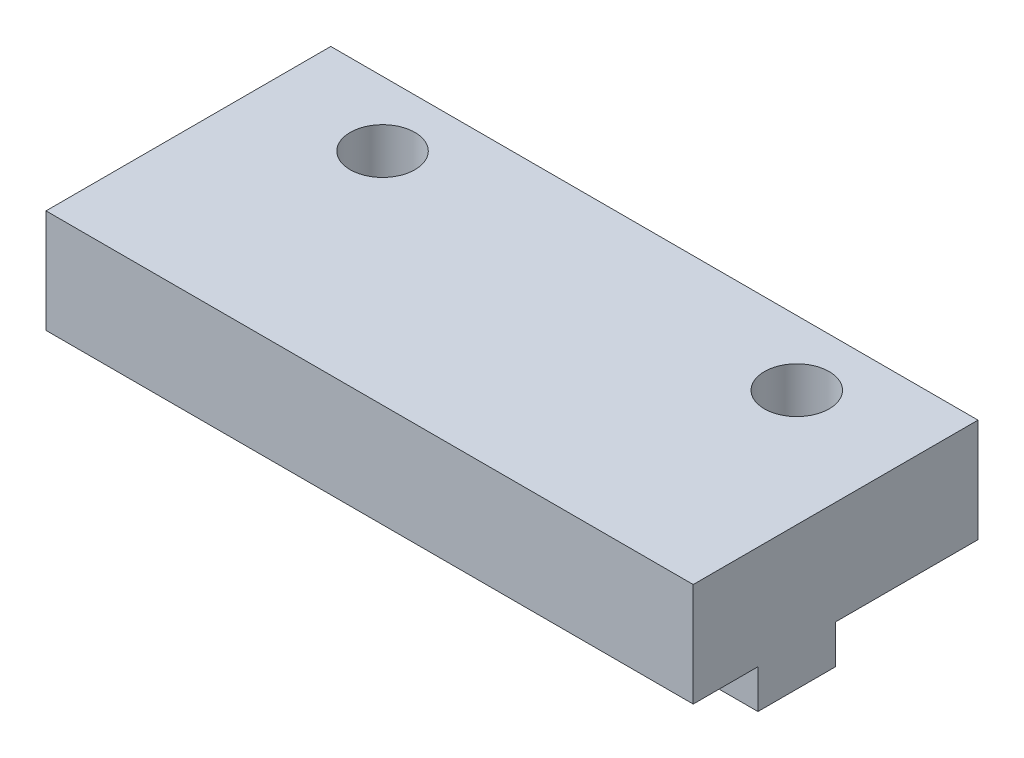
from build123d import *

# Parameters (mm, degrees)
SKETCH1_W           = 25
SKETCH1_H           = 5
SKETCH1_R           = 1.25
BOSS_EXTRUDE1_DEPTH = 4
SKETCH2_W           = 25
SKETCH2_H           = 4
BOSS_EXTRUDE2_DEPTH = 6
SKETCH3_W           = 25
SKETCH3_H           = 3
BOSS_EXTRUDE3_DEPTH = 1.5


with BuildPart() as part:
    # Sketch1 → Boss-Extrude1 (new body)
    with BuildSketch(Plane(origin=(0, 0, 0), x_dir=(1, 0, 0), z_dir=(0, 1, 0))):
        with Locations((12.5, 2.5)):
            Rectangle(SKETCH1_W, SKETCH1_H)
        with Locations(Location((4.5, 2.5, 0), (0, 0, 270))):
            Circle(SKETCH1_R, mode=Mode.SUBTRACT)
        with Locations(Location((20.5, 2.5, 0), (0, 0, 270))):
            Circle(SKETCH1_R, mode=Mode.SUBTRACT)
    extrude(amount=BOSS_EXTRUDE1_DEPTH)

    # Sketch2 → Boss-Extrude2 (add)
    with BuildSketch(Plane.XY):
        with Locations((12.5, 2)):
            Rectangle(SKETCH2_W, SKETCH2_H)
    extrude(amount=BOSS_EXTRUDE2_DEPTH)

    # Sketch3 → Boss-Extrude3 (add)
    with BuildSketch(Plane.XZ):
        with Locations((12.5, 2)):
            Rectangle(SKETCH3_W, SKETCH3_H)
    extrude(amount=BOSS_EXTRUDE3_DEPTH)


solid = part.part
